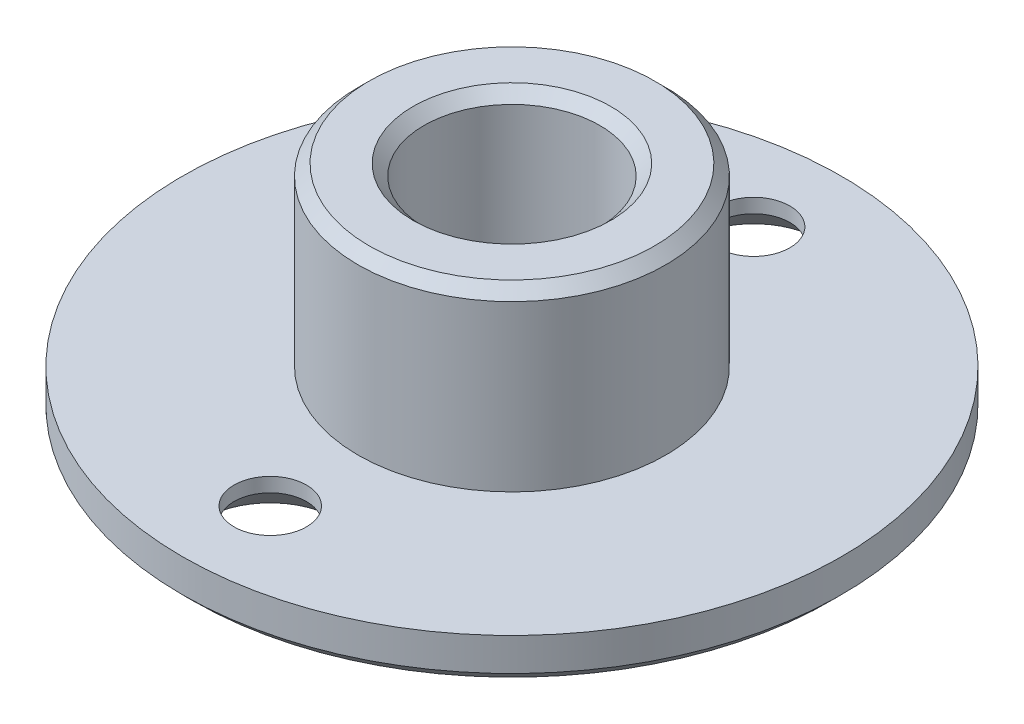
from build123d import *

# Parameters (mm, degrees)
SKETCH_1_R                   = 15
EXTRUDE_1_DEPTH              = 2
SKETCH_2_R                   = 7
EXTRUDE_2_DEPTH              = 8
F_8_0MM_1_D                  = 8
HOLE_WIZARD_M6_1_D           = 3.3
HOLE_WIZARD_M6_1_CSINK_D     = 6
HOLE_WIZARD_M6_1_CSINK_ANGLE = 90
CHAMFER_1_SIZE               = 0.5


with BuildPart() as part:
    # 草图1 → 凸台-拉伸1 (new body)
    with BuildSketch(Plane(origin=(0, 0, 0), x_dir=(1, 0, 0), z_dir=(0, 1, 0))):
        with Locations(Location((0, 0, 0), (0, 0, 270))):
            Circle(SKETCH_1_R)
    extrude(amount=EXTRUDE_1_DEPTH)

    # 草图2 → 凸台-拉伸2 (add)
    with BuildSketch(Plane(origin=(0, 2, 0), x_dir=(1, 0, 0), z_dir=(0, 1, 0))):
        with Locations(Location((0, 0, 0), (0, 0, 270))):
            Circle(SKETCH_2_R)
    extrude(amount=EXTRUDE_2_DEPTH)

    # Ø8.0mm 暗销孔1 (through all)
    with Locations(Plane.ZX.offset(10)):
        with Locations((0, 0)):
            Hole(F_8_0MM_1_D / 2)

    # M6 内六角花形半沉头螺钉的锥形沉头孔1 (through all)
    with Locations(Plane(origin=(0, 0, -11), x_dir=(0, 0, -1), z_dir=(0, -1, 0))):
        with Locations((0, 0)):
            hole_wizard_m6_1 = CounterSinkHole(HOLE_WIZARD_M6_1_D / 2, HOLE_WIZARD_M6_1_CSINK_D / 2, counter_sink_angle=HOLE_WIZARD_M6_1_CSINK_ANGLE)

    # 镜向1: M6 内六角花形半沉头螺钉的锥形沉头孔1 across plane
    add(hole_wizard_m6_1.mirror(Plane.XY), mode=Mode.SUBTRACT)

    # 倒角1
    chamfer_1_edges = [part.edges().sort_by_distance(p)[0] for p in [
        (0, 10, 4),
        (0, 0, 4),
        (0, 0, -15),
        (0, 10, -7),
    ]]
    chamfer(chamfer_1_edges, length=CHAMFER_1_SIZE)


solid = part.part
